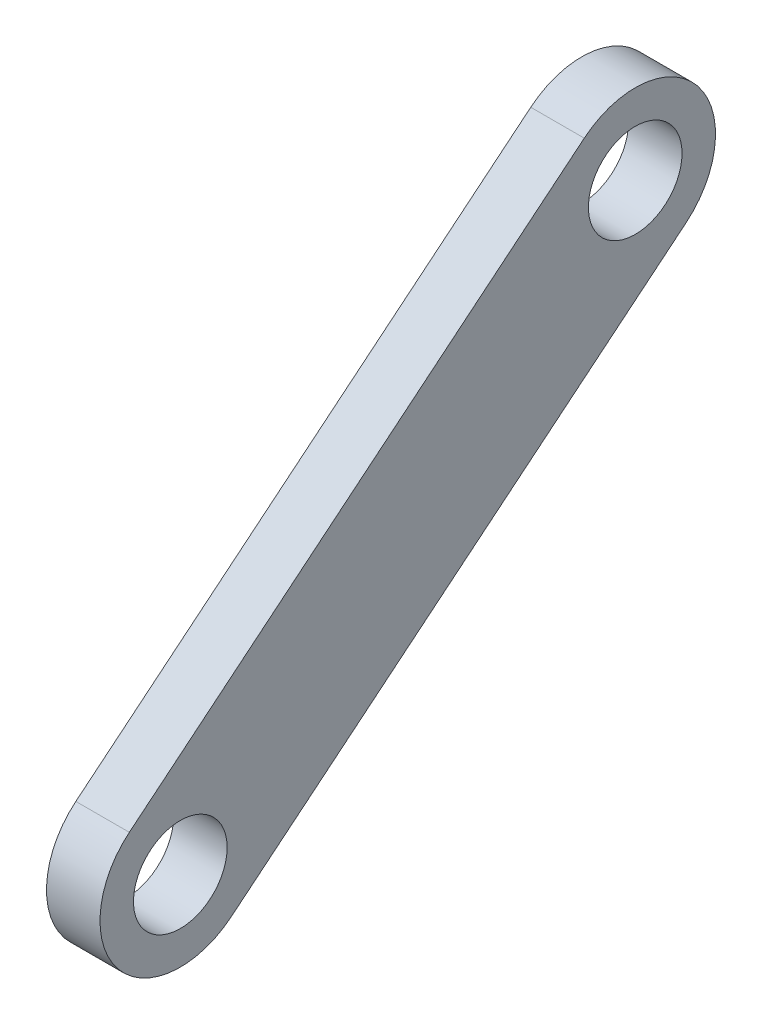
from build123d import *

# Parameters (mm, degrees)
BOSS_EXTRUDE1_DEPTH = 12.7


with BuildPart() as part:
    # Sketch1 → Boss-Extrude1 (new body)
    with BuildSketch(Plane(origin=(0, 0, 0), x_dir=(0, 0, -1), z_dir=(1, 0, 0))):
        with BuildLine():
            ThreePointArc((8.586931818, -7.053528068), (-11.1125, 0), (8.586931818, 7.053528068))
            Line((8.586931818, 7.053528068), (99.363068182, 81.61939621))
            ThreePointArc((99.363068182, 81.61939621), (104.203977014, 99.134997115), (119.0625, 88.672924278))
            ThreePointArc((119.0625, 88.672924278), (118.412072837, 84.926901292), (116.536931818, 81.61939621))
            Line((116.536931818, 81.61939621), (122.670454545, 76.581161876))
            ThreePointArc((122.670454545, 76.581161876), (121.420384182, 102.14330846), (95.858237598, 103.393378823))
            Line((95.858237598, 103.393378823), (-12.091762402, 14.720454545))
            ThreePointArc((-12.091762402, 14.720454545), (-14.720454545, -12.091762402), (12.091762402, -14.720454545))
            Line((12.091762402, -14.720454545), (15.006187185, -12.326470588))
            Line((15.006187185, -12.326470588), (8.586931818, -7.053528068))
        make_face()
        with BuildLine():
            Line((99.363068182, 81.61939621), (8.586931818, 7.053528068))
            ThreePointArc((8.586931818, 7.053528068), (10.462072837, 3.746022986), (11.1125, 0))
            ThreePointArc((11.1125, 0), (10.462072837, -3.746022986), (8.586931818, -7.053528068))
            Line((8.586931818, -7.053528068), (15.006187185, -12.326470588))
            Line((15.006187185, -12.326470588), (120.041762402, 73.952469732))
            ThreePointArc((120.041762402, 73.952469732), (121.420384182, 75.202540096), (122.670454545, 76.581161876))
            Line((122.670454545, 76.581161876), (116.536931818, 81.61939621))
            ThreePointArc((116.536931818, 81.61939621), (107.95, 77.560424278), (99.363068182, 81.61939621))
        make_face()
    extrude(amount=BOSS_EXTRUDE1_DEPTH)


solid = part.part
